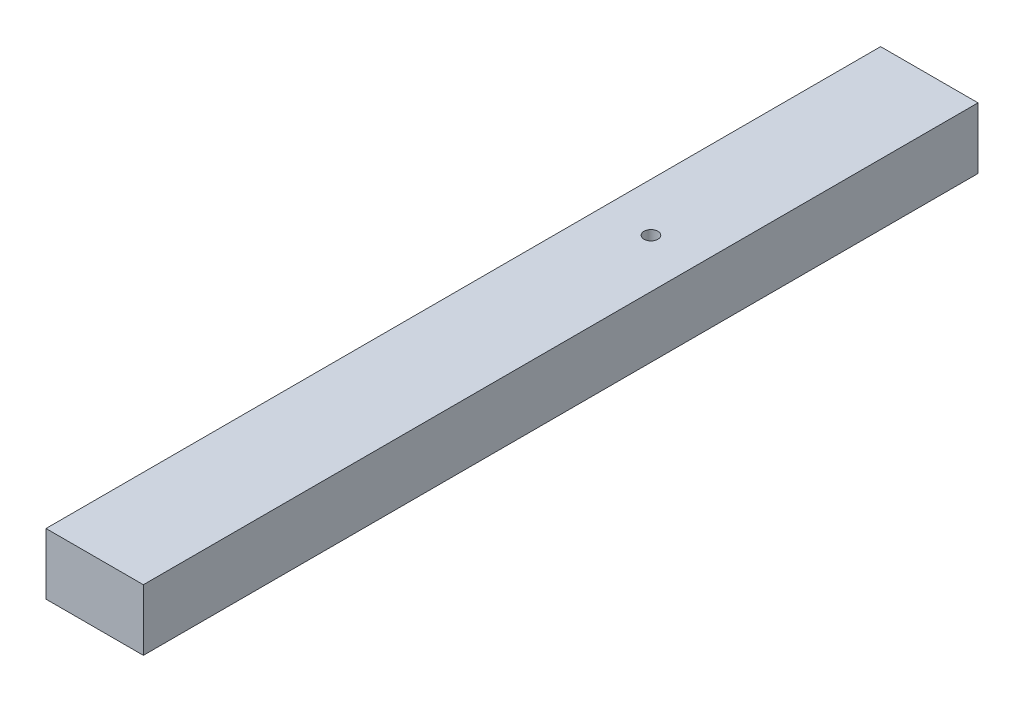
from build123d import *

# Parameters (mm, degrees)
SKETCH2_W          = 70
SKETCH2_H          = 44
EXTRUDE1_DEPTH     = 600
CUT_EXTRUDE1_REACH = 607.67
SKETCH3_R          = 5


with BuildPart() as part:
    # Sketch2 → Extrude1 (new body)
    with BuildSketch(Plane.XY):
        with Locations((35, 22)):
            Rectangle(SKETCH2_W, SKETCH2_H)
    extrude(amount=EXTRUDE1_DEPTH)

    # Sketch3 → Cut-Extrude1 (cut, up to next)
    with BuildSketch(Plane(origin=(0, 44, 0), x_dir=(-1, 0, 0), z_dir=(0, 1, 0)), mode=Mode.PRIVATE) as cut_extrude1_sk1:
        with Locations(Location((-34.89201671, 200, 0), (0, 0, 90))):
            Circle(SKETCH3_R)
    cut_extrude1_tool1 = extrude(cut_extrude1_sk1.sketch, amount=-CUT_EXTRUDE1_REACH, mode=Mode.PRIVATE) & part.part
    add(cut_extrude1_tool1.solids().sort_by_distance((34.892017, 44, 200))[0], mode=Mode.SUBTRACT)


solid = part.part
